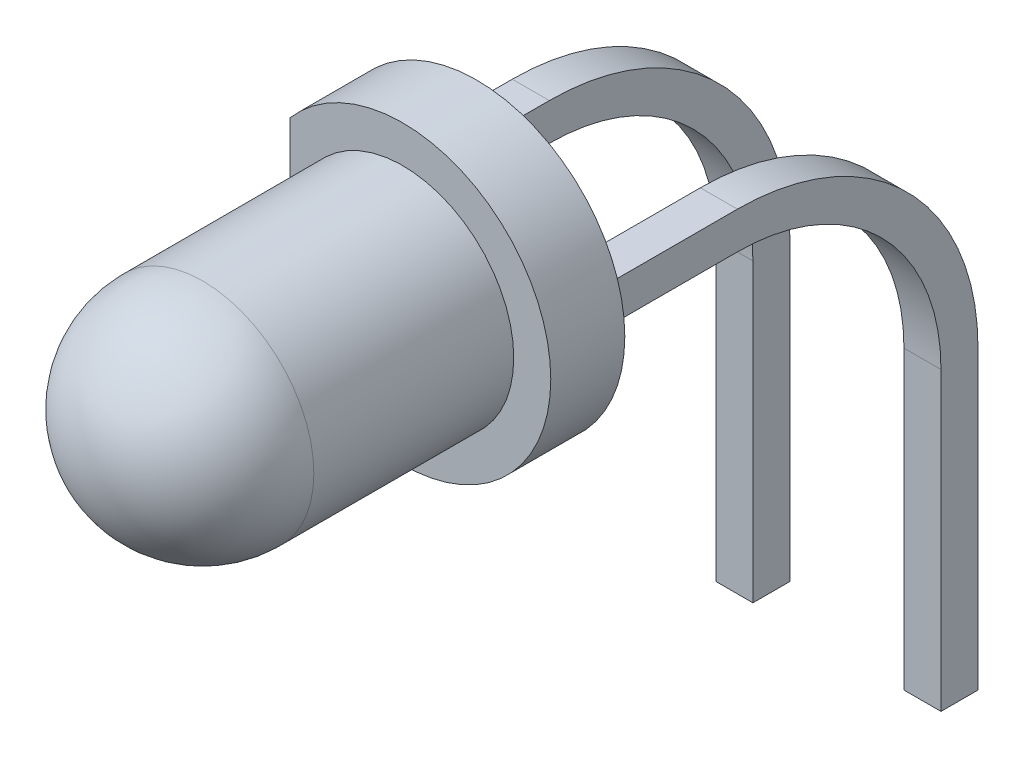
from build123d import *

# Parameters (mm, degrees)
EXTRUDE_START   = 5
EXTRUDE_2_DEPTH = 1
SKETCH_4_W      = 0.5
SKETCH_4_H      = 0.5


with BuildPart() as part:
    # Эскиз2 → Бобышка-Вытянуть2 (new body)
    with BuildSketch(Plane.XY.offset(EXTRUDE_START)):
        with BuildLine():
            Line((-1.52, 4.299846145), (-1.52, 1.700153855))
            ThreePointArc((-1.52, 1.700153855), (2, 3), (-1.52, 4.299846145))
        make_face()
    extrude(amount=EXTRUDE_2_DEPTH)

    # Эскиз3 → Повернуть1 (revolve)
    with BuildSketch(Plane(origin=(0, 0, 0), x_dir=(0, -1, 0), z_dir=(1, 0, 0)), mode=Mode.PRIVATE) as revolve_1_sk:
        with BuildLine():
            Line((-4.5, -6), (-4.5, -8.7))
            ThreePointArc((-4.5, -8.7), (-4.060660172, -9.760660172), (-3, -10.2))
            Line((-3, -10.2), (-3, -6))
            Line((-3, -6), (-4.5, -6))
        make_face()
    revolve(revolve_1_sk.sketch.rotate(Axis((0, 3, 13.296819565), (0, 0, -1)), 90), axis=Axis((0, 3, 13.296819565), (0, 0, -1)))


with BuildPart() as body_2:
    # По траектории2: sweep along a path in Эскиз5
    with BuildLine(Plane(origin=(0, 0, 0), x_dir=(0, 0, -1), z_dir=(1, 0, 0))) as sweep_2_path:
        Line((-5, 3), (-3, 3))
        ThreePointArc((-3, 3), (-0.878679656, 2.121320344), (0, 0))
        Line((0, 0), (0, -4))
    # Эскиз4 → По траектории2 (sweep)
    with BuildSketch(Plane.XY.offset(5)):
        with Locations((-1.27, 3)):
            Rectangle(SKETCH_4_W, SKETCH_4_H)
        with Locations((1.27, 3)):
            Rectangle(SKETCH_4_W, SKETCH_4_H)
    sweep(path=sweep_2_path.line)


solid = Compound([part.part, body_2.part])
